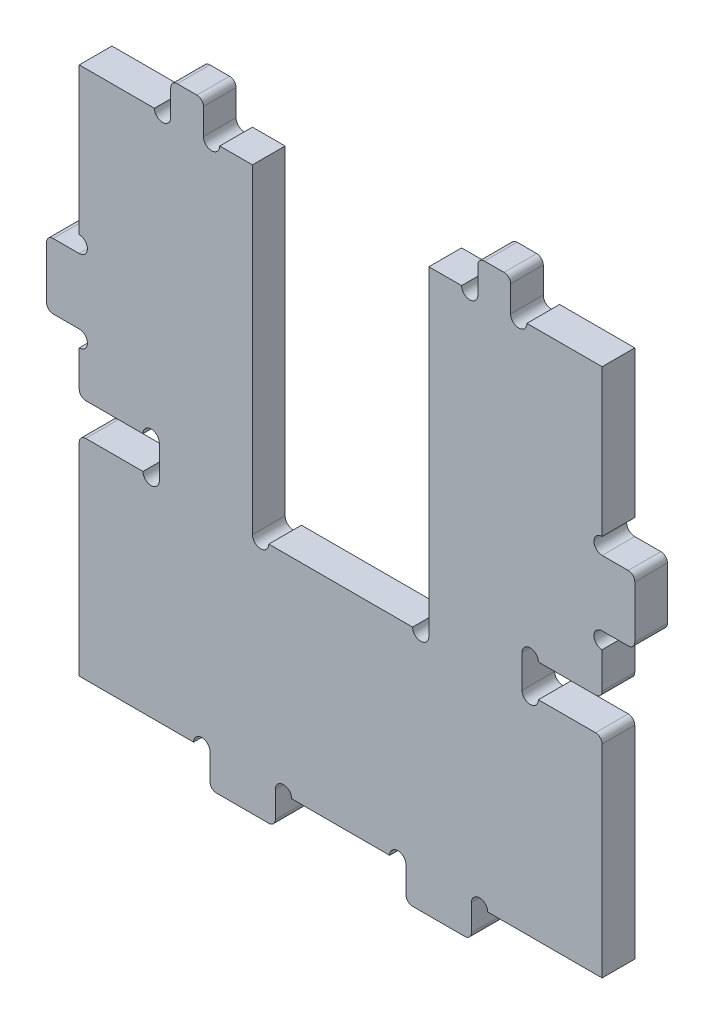
from build123d import *

# Parameters (mm, degrees)
SKETCH_1_W          = 80
SKETCH_1_H          = 81
EXTRUDE_1_DEPTH     = 5
SKETCH_2_W          = 12.25
SKETCH_2_H          = 5
SKETCH_2_W_2        = 27
SKETCH_2_H_2        = 49
CUT_EXTRUDE_1_DEPTH = 10
SKETCH_5_W          = 10
SKETCH_5_H          = 5
SKETCH_5_W_2        = 5
SKETCH_5_H_2        = 10
EXTRUDE_2_DEPTH     = 5
FILLET_1_R          = 1
SKETCH_6_R          = 1.25
CUT_EXTRUDE_4_DEPTH = 10


with BuildPart() as part:
    # 스케치1 → 보스-돌출1 (new body)
    with BuildSketch(Plane.XY):
        with Locations((-45, 45.5)):
            Rectangle(SKETCH_1_W, SKETCH_1_H)
    extrude(amount=-EXTRUDE_1_DEPTH)

    # 스케치2 → 컷-돌출1 (cut)
    with BuildSketch(Plane.XY):
        with Locations((-11.125, 39.5)):
            Rectangle(SKETCH_2_W, SKETCH_2_H)
        with Locations((-45, 61.5)):
            Rectangle(SKETCH_2_W_2, SKETCH_2_H_2)
        with Locations((-78.875, 39.5)):
            Rectangle(SKETCH_2_W, SKETCH_2_H)
    extrude(amount=-CUT_EXTRUDE_1_DEPTH, mode=Mode.SUBTRACT)

    # 스케치5 → 보스-돌출2 (add)
    with BuildSketch(Plane.XY):
        with Locations((-30, 2.5)):
            Rectangle(SKETCH_5_W, SKETCH_5_H)
        with Locations((-60, 2.5)):
            Rectangle(SKETCH_5_W, SKETCH_5_H)
        with Locations((-2.5, 56)):
            Rectangle(SKETCH_5_W_2, SKETCH_5_H_2)
        with Locations((-87.5, 56)):
            Rectangle(SKETCH_5_W_2, SKETCH_5_H_2)
        with Locations((-68.5, 88.5)):
            Rectangle(SKETCH_5_W_2, SKETCH_5_H)
        with Locations((-21.5, 88.5)):
            Rectangle(SKETCH_5_W_2, SKETCH_5_H)
    extrude(amount=-EXTRUDE_2_DEPTH)

    # 필렛1
    fillet_1_edges = [part.edges().sort_by_distance(p)[0] for p in [
        (-19, 91, -2.5),
        (-66, 91, -2.5),
        (-71, 91, -2.5),
        (-24, 91, -2.5),
        (-65, 0, -2.5),
        (-35, 0, -2.5),
        (-55, 0, -2.5),
        (-25, 0, -2.5),
        (-5, 37, -2.5),
        (-5, 42, -2.5),
        (0, 61, -2.5),
        (0, 51, -2.5),
        (-85, 37, -2.5),
        (-85, 42, -2.5),
        (-90, 51, -2.5),
        (-90, 61, -2.5),
    ]]
    fillet(fillet_1_edges, radius=FILLET_1_R)

    # 스케치6 → 컷-돌출4 (cut)
    with BuildSketch(Plane.XY):
        with Locations((-32.75, 37)):
            Circle(SKETCH_6_R)
        with Locations((-57.25, 37)):
            Circle(SKETCH_6_R)
        with Locations((-74, 42)):
            Circle(SKETCH_6_R)
        with Locations((-74, 37)):
            Circle(SKETCH_6_R)
        with Locations((-16, 42)):
            Circle(SKETCH_6_R)
        with Locations((-16, 37)):
            Circle(SKETCH_6_R)
        with Locations((-5, 49.75)):
            Circle(SKETCH_6_R)
        with Locations((-5, 62.25)):
            Circle(SKETCH_6_R)
        with Locations((-85, 62.25)):
            Circle(SKETCH_6_R)
        with Locations((-85, 49.75)):
            Circle(SKETCH_6_R)
        with Locations((-66.25, 5)):
            Circle(SKETCH_6_R)
        with Locations((-53.75, 5)):
            Circle(SKETCH_6_R)
        with Locations((-36.25, 5)):
            Circle(SKETCH_6_R)
        with Locations((-23.75, 5)):
            Circle(SKETCH_6_R)
        with Locations((-72.25, 86)):
            Circle(SKETCH_6_R)
        with Locations((-64.75, 86)):
            Circle(SKETCH_6_R)
        with Locations((-25.25, 86)):
            Circle(SKETCH_6_R)
        with Locations((-17.75, 86)):
            Circle(SKETCH_6_R)
    extrude(amount=-CUT_EXTRUDE_4_DEPTH, mode=Mode.SUBTRACT)


solid = part.part
